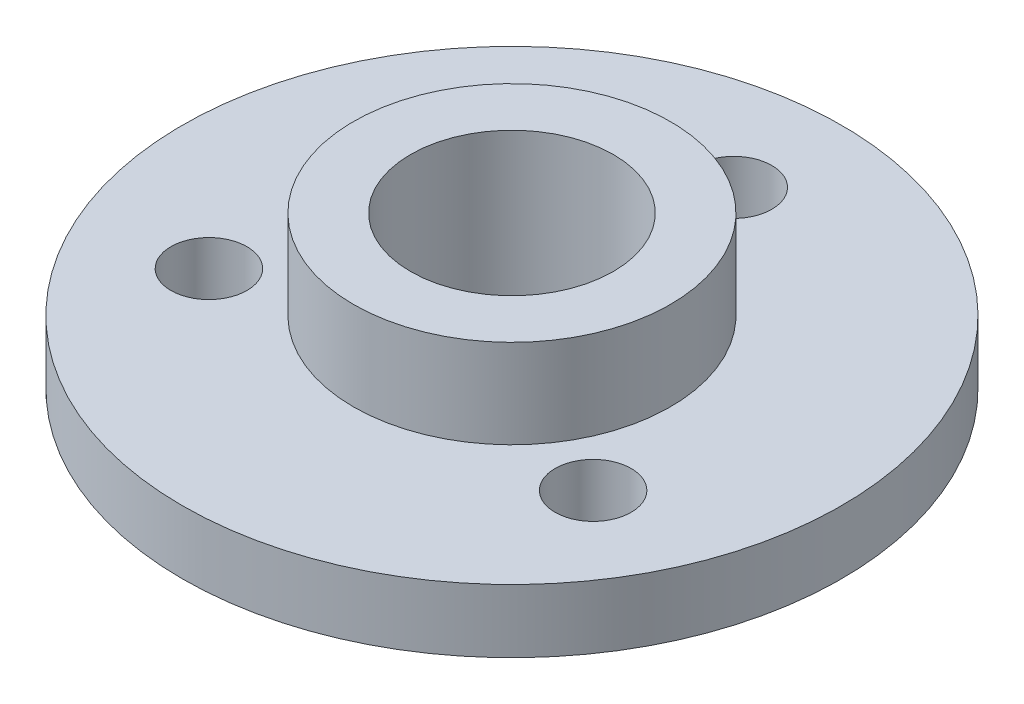
from build123d import *

# Parameters (mm, degrees)
SKETCH2_R           = 26
BOSS_EXTRUDE1_DEPTH = 5
SKETCH3_R           = 12.5
SKETCH3_R_2         = 8
BOSS_EXTRUDE2_DEPTH = 7
SKETCH4_R           = 8
CUT_EXTRUDE1_DEPTH  = 38.429934544
SKETCH6_R           = 3
CUT_EXTRUDE2_DEPTH  = 38.429934544


with BuildPart() as part:
    # Sketch2 → Boss-Extrude1 (new body)
    with BuildSketch(Plane(origin=(0, 0, 0), x_dir=(1, 0, 0), z_dir=(0, 1, 0))):
        with Locations(Location((0, 0, 0), (0, 0, 270))):
            Circle(SKETCH2_R)
    extrude(amount=BOSS_EXTRUDE1_DEPTH)

    # Sketch3 → Boss-Extrude2 (add)
    with BuildSketch(Plane(origin=(0, 5, 0), x_dir=(1, 0, 0), z_dir=(0, 1, 0))):
        with Locations(Location((0, 0, 0), (0, 0, 270))):
            Circle(SKETCH3_R)
        with Locations(Location((0, 0, 0), (0, 0, 270))):
            Circle(SKETCH3_R_2, mode=Mode.SUBTRACT)
    extrude(amount=BOSS_EXTRUDE2_DEPTH)

    # Sketch4 → Cut-Extrude1 (cut, through all)
    with BuildSketch(Plane(origin=(0, 5, 0), x_dir=(1, 0, 0), z_dir=(0, 1, 0))):
        with Locations(Location((0, 0, 0), (0, 0, 270))):
            Circle(SKETCH4_R)
    extrude(amount=-CUT_EXTRUDE1_DEPTH, mode=Mode.SUBTRACT)

    # Sketch6 → Cut-Extrude2 (cut, through all)
    with BuildSketch(Plane(origin=(0, 5, 0), x_dir=(1, 0, 0), z_dir=(0, 1, 0))):
        with Locations(Location((0, 17.5, 0), (0, 0, 270))):
            Circle(SKETCH6_R)
        with Locations(Location((15.155444566, -8.75, 0), (0, 0, 270))):
            Circle(SKETCH6_R)
        with Locations(Location((-15.155444566, -8.75, 0), (0, 0, 270))):
            Circle(SKETCH6_R)
    extrude(amount=-CUT_EXTRUDE2_DEPTH, mode=Mode.SUBTRACT)


solid = part.part
